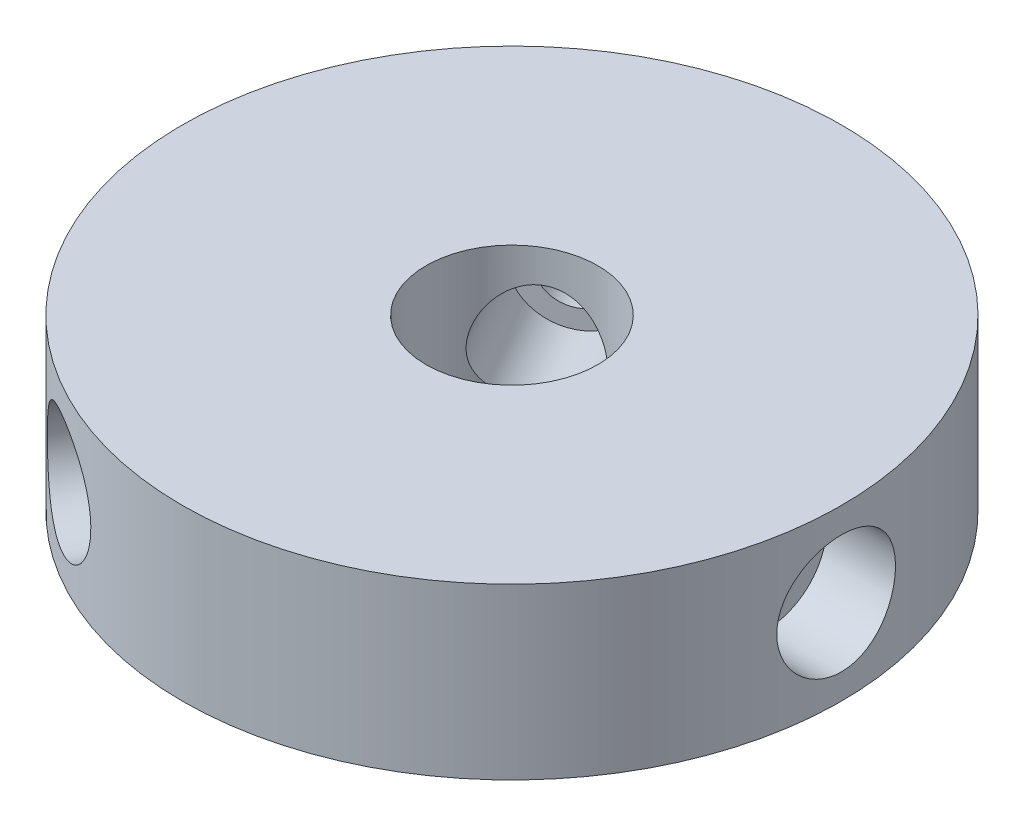
from build123d import *

# Parameters (mm, degrees)
SKETCH1_R           = 15.55
SKETCH1_R_2         = 4.05
BOSS_EXTRUDE1_DEPTH = 4
CIRPATTERN1_COUNT   = 3


with BuildPart() as part:
    # Sketch1 → Boss-Extrude1 (new, symmetric)
    with BuildSketch(Plane(origin=(0, 0, 0), x_dir=(1, 0, 0), z_dir=(0, 1, 0))):
        with Locations(Location((0, 0, 0), (0, 0, 270))):
            Circle(SKETCH1_R)
        with Locations(Location((0, 0, 0), (0, 0, 270))):
            Circle(SKETCH1_R_2, mode=Mode.SUBTRACT)
    extrude(amount=BOSS_EXTRUDE1_DEPTH, both=True)

    # Sketch3 → Cut-Revolve1 (revolve, cut)
    with BuildSketch(Plane(origin=(0, 0, 0), x_dir=(1, 0, 0), z_dir=(0, 1, 0)), mode=Mode.PRIVATE) as cut_revolve1_sk:
        Polygon((15.55, 0), (15.55, 2.8), (12.05, 2.8), (12.05, 1.55), (8.55, 1.55), (8.55, 2.45), (1.114592602, 2.45), (1.114592602, 0), align=None)
    cut_revolve1 = revolve(cut_revolve1_sk.sketch.rotate(Axis((0, 0, 0), (1, 0, 0)), 180), axis=Axis((0, 0, 0), (1, 0, 0)), mode=Mode.SUBTRACT)

    # CirPattern1: Cut-Revolve1 ×3 about axis
    cirpattern1_axis = Axis((0, 0, 0), (0, 1, 0))
    for i in range(1, CIRPATTERN1_COUNT):
        add(cut_revolve1.rotate(cirpattern1_axis, i * 360 / CIRPATTERN1_COUNT), mode=Mode.SUBTRACT)


solid = part.part
